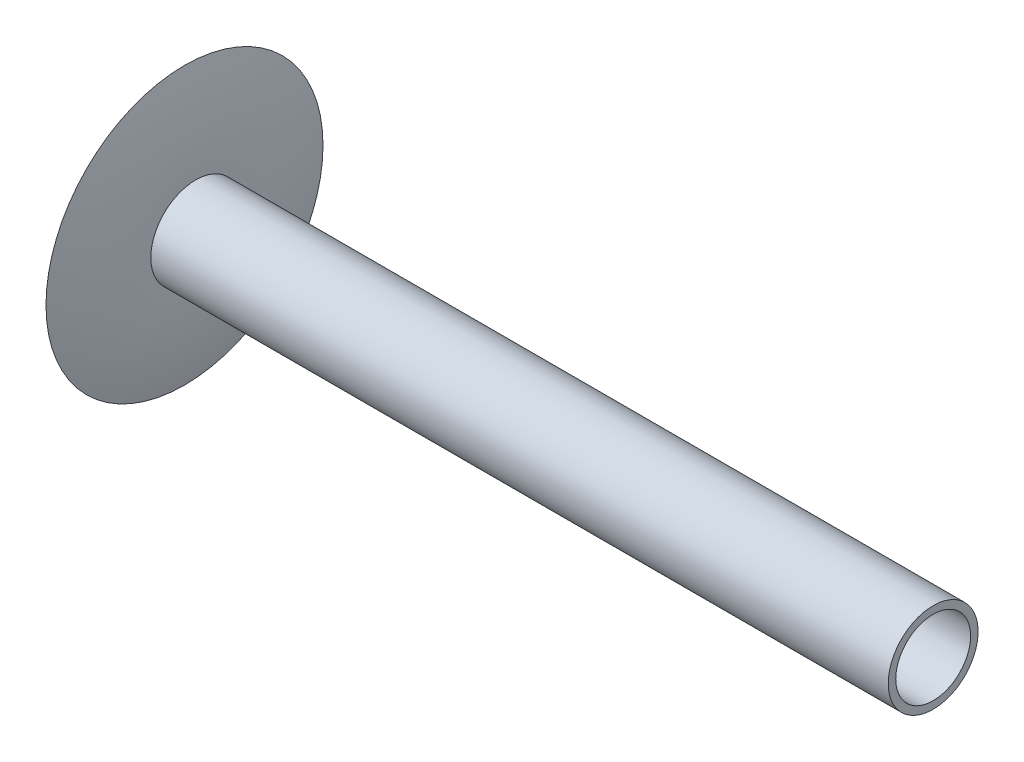
from build123d import *


with BuildPart() as part:
    # Sketch1 → Revolve1 (revolve)
    with BuildSketch(Plane.XY, mode=Mode.PRIVATE) as revolve1_sk:
        with BuildLine():
            Line((3, -12), (0, -12))
            Line((0, -12), (0, -37))
            ThreePointArc((0, -37), (2.325217654, -24.599026118), (3, -12))
        make_face()
        Polygon((200, -10), (0, -10), (0, -12), (3, -12), (200, -12), align=None)
    revolve(revolve1_sk.sketch.rotate(Axis((0, 0, 0), (1, 0, 0)), 270), axis=Axis((0, 0, 0), (1, 0, 0)))


solid = part.part
